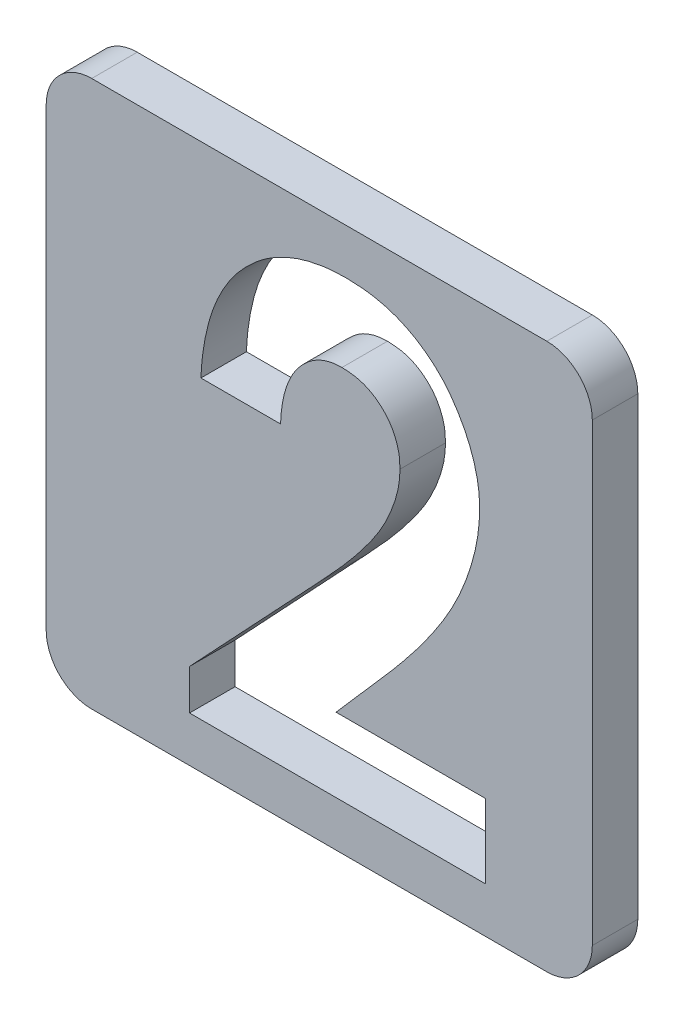
from build123d import *

# Parameters (mm, degrees)
BOSS_EXTRUDE1_DEPTH = 10
CUT_EXTRUDE3_DEPTH  = 10


with BuildPart() as part:
    # Sketch1 → Boss-Extrude1 (new body)
    with BuildSketch(Plane.XY):
        with BuildLine():
            Line((-50, 60), (50, 60))
            ThreePointArc((50, 60), (57.071067812, 57.071067812), (60, 50))
            Line((60, 50), (60, -50))
            ThreePointArc((60, -50), (57.071067812, -57.071067812), (50, -60))
            Line((50, -60), (-50, -60))
            ThreePointArc((-50, -60), (-57.071067812, -57.071067812), (-60, -50))
            Line((-60, -50), (-60, 50))
            ThreePointArc((-60, 50), (-57.071067812, 57.071067812), (-50, 60))
        make_face()
    extrude(amount=BOSS_EXTRUDE1_DEPTH)

    # Sketch2 → Cut-Extrude3 (cut)
    with BuildSketch(Plane.XY.offset(10)):
        with BuildLine():
            Line((-8.5, 15), (-26, 15))
            add(Edge.make_bspline(
                [(-26, 15), (-25.924420184, 16.323782417), (-25.776741761, 18.910373782), (-25.18931432, 22.667480561), (-24.40218171, 26.217533319), (-23.351648748, 29.548113585), (-22.031585343, 32.658011133), (-20.475960128, 35.557827774), (-18.645030413, 38.232295908), (-16.577764404, 40.66851774), (-14.30925859, 42.854074827), (-11.88660938, 44.791927043), (-9.27275909, 46.390993922), (-6.515464901, 47.70687792), (-3.615196326, 48.758208087), (-0.544512267, 49.461107381), (2.66999963, 49.937117669), (4.870593326, 49.978770479), (5.9921875, 50)],
                knots=[0, 0, 0, 0, 1.199038563, 2.342849363, 3.436047546, 4.486744587, 5.497670872, 6.488682221, 7.459191391, 8.424610317, 9.374430501, 10.305433194, 11.225809216, 12.140057399, 13.06607119, 14.010487599, 14.985989317, 16, 16, 16, 16], degree=3))
            add(Edge.make_bspline(
                [(5.9921875, 50), (7.368928437, 49.957042053), (10.056649381, 49.873178074), (13.962121102, 49.157790502), (17.609404678, 47.961194237), (20.995848876, 46.289233684), (24.092624303, 44.165183063), (26.899217428, 41.632600324), (29.3307524, 38.638350552), (31.402645865, 35.307019593), (33.124141711, 31.779608953), (34.330494291, 28.132120076), (35.123416859, 24.461342527), (35.207986958, 21.989626722), (35.25, 20.76171875)],
                knots=[0, 0, 0, 0, 1.075374347, 2.099382735, 3.09057751, 4.06680945, 5.040638231, 6.016817125, 7.011024321, 8.044445721, 9.0776792, 10.070479129, 11.0414456, 12, 12, 12, 12], degree=3))
            add(Edge.make_bspline(
                [(35.25, 20.76171875), (35.23364234, 20.018993224), (35.200718412, 18.524070203), (34.971793962, 16.261884765), (34.628362052, 13.957584415), (34.110550426, 11.613144874), (33.464796878, 9.227908959), (32.681404487, 6.794738479), (31.742201696, 4.327428619), (30.662861893, 1.798210228), (29.375206772, -0.801128076), (27.875911369, -3.509551386), (26.125180985, -6.324657117), (24.144162236, -9.262340273), (21.923233789, -12.317967673), (19.451553804, -15.482334813), (16.757590231, -18.766591913), (14.845608498, -20.961933477), (13.86328125, -22.08984375)],
                knots=[0, 0, 0, 0, 0.728284026, 1.46585585, 2.227944881, 3.01186502, 3.81876927, 4.650621989, 5.517437689, 6.406905708, 7.346299482, 8.360816762, 9.441613733, 10.596154504, 11.834900912, 13.145207542, 14.533280747, 16, 16, 16, 16], degree=3))
            Line((13.86328125, -22.08984375), (3.6875, -33.75))
            Line((3.6875, -33.75), (36.5, -33.75))
            Line((36.5, -33.75), (36.5, -50))
            Line((36.5, -50), (-28.5, -50))
            Line((-28.5, -50), (-28.5, -41.1328125))
            Line((-28.5, -41.1328125), (0.3671875, -10.41015625))
            add(Edge.make_bspline(
                [(0.3671875, -10.41015625), (1.20296676, -9.513966827), (2.821623334, -7.778313684), (5.124804826, -5.229322392), (7.208980625, -2.810390499), (9.03093365, -0.495761262), (10.686277651, 1.639488168), (12.101200969, 3.659716873), (13.288649043, 5.546661257), (14.577792347, 7.821986632), (15.802054714, 10.535717034), (16.925389532, 13.662045728), (17.61013984, 16.650095948), (17.704657037, 18.597173702), (17.75, 19.53125)],
                knots=[0, 0, 0, 0, 1.246127091, 2.413378631, 3.493388633, 4.492180848, 5.408488754, 6.240484944, 6.999099869, 7.674939598, 8.898438119, 10.020720584, 11.050475521, 12, 12, 12, 12], degree=3))
            add(Edge.make_bspline(
                [(17.75, 19.53125), (17.716098162, 20.434896755), (17.650407917, 22.185857222), (16.928525346, 24.676589164), (15.810159831, 26.931692678), (14.234224873, 28.883782729), (12.325274062, 30.487944566), (10.119302085, 31.681075072), (7.634294101, 32.369505905), (5.892256158, 32.45567285), (4.99609375, 32.5)],
                knots=[0, 0, 0, 0, 1.062038974, 2.057870785, 3.028805853, 4.01125022, 4.991535629, 5.949134679, 6.94496649, 8, 8, 8, 8], degree=3))
            add(Edge.make_bspline(
                [(4.99609375, 32.5), (4.533124834, 32.48362502), (3.621696175, 32.451388241), (2.281967285, 32.23679673), (1.007118995, 31.858601591), (-0.217038468, 31.351873335), (-1.377440572, 30.680201393), (-2.471160416, 29.852258715), (-3.50972172, 28.889085204), (-4.488361226, 27.793692576), (-5.379050933, 26.571234082), (-6.170158274, 25.23287438), (-6.824272345, 23.77944423), (-7.400178148, 22.230131129), (-7.84434426, 20.568294193), (-8.167752291, 18.803879329), (-8.413617819, 16.93975701), (-8.470682125, 15.658348204), (-8.5, 15)],
                knots=[0, 0, 0, 0, 0.903469896, 1.778625579, 2.63899355, 3.493148037, 4.358286772, 5.247621495, 6.164656832, 7.118446693, 8.109501108, 9.111810964, 10.146451449, 11.215617525, 12.33435995, 13.498009769, 14.714554818, 16, 16, 16, 16], degree=3))
        make_face()
    extrude(amount=-CUT_EXTRUDE3_DEPTH, mode=Mode.SUBTRACT)


solid = part.part
